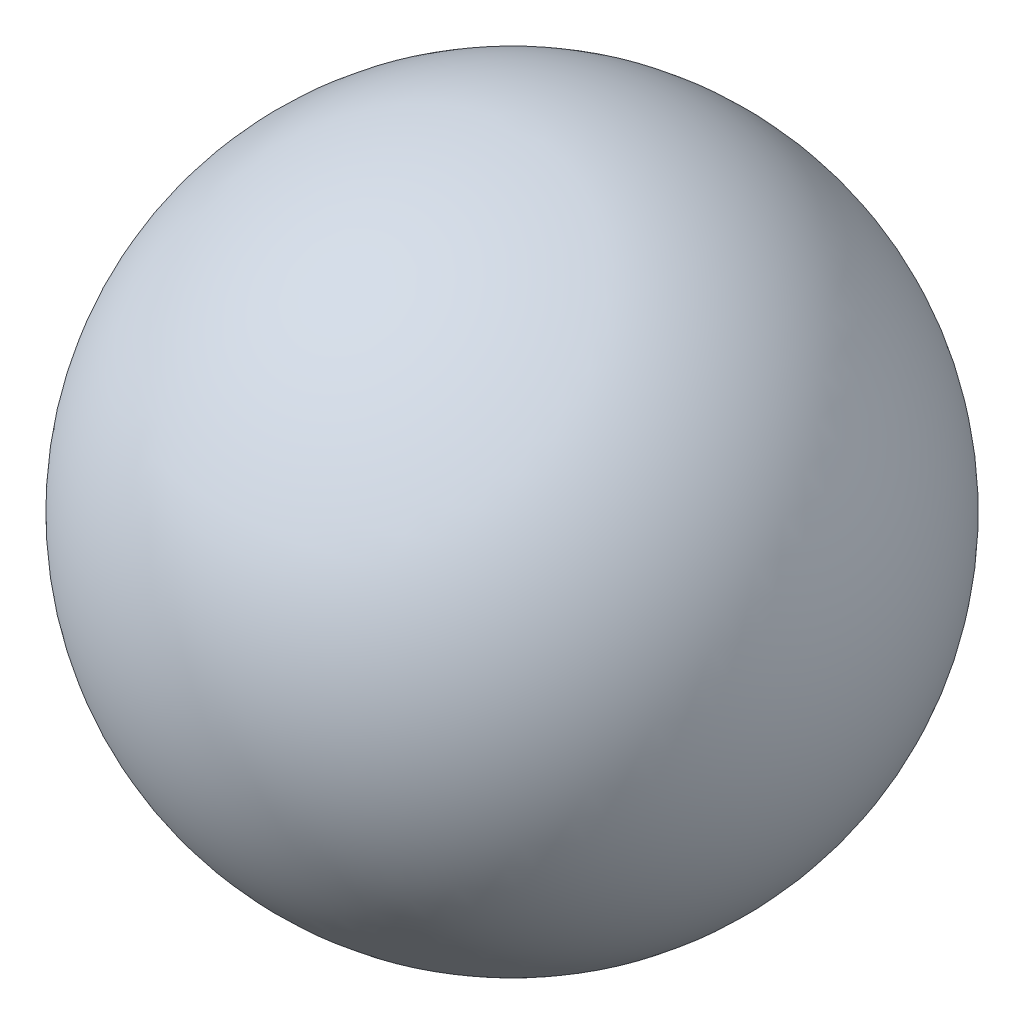
from build123d import *


with BuildPart() as part:
    # Sketch1 → Revolve1 (revolve)
    with BuildSketch(Plane.XY):
        with BuildLine():
            Line((0, -1.389), (0, 1.389))
            ThreePointArc((0, 1.389), (1.389, 0), (0, -1.389))
        make_face()
    revolve(axis=Axis((0, 1.389, 0), (0, -1, 0)))


solid = part.part
